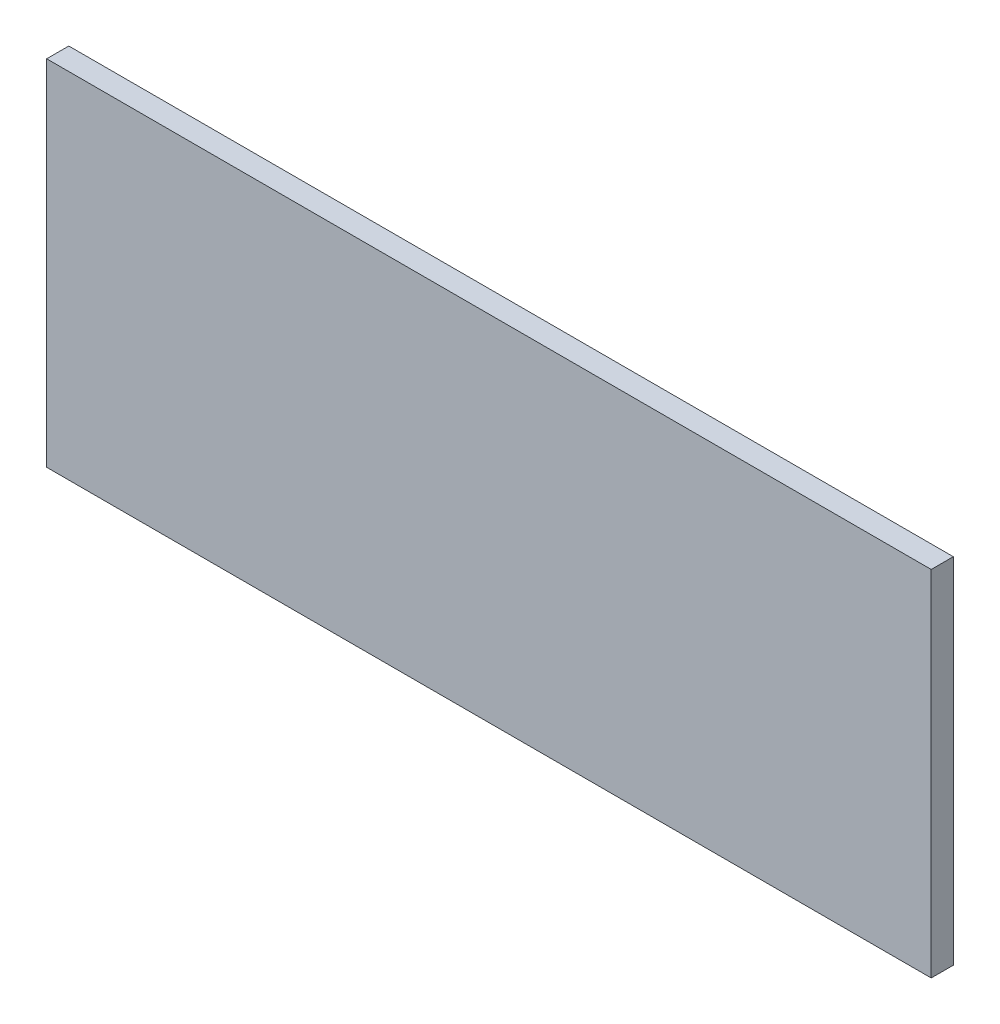
from build123d import *

# Parameters (mm, degrees)
SKETCH3_W           = 200
SKETCH3_H           = 80
BOSS_EXTRUDE1_DEPTH = 5


with BuildPart() as part:
    # Sketch3 → Boss-Extrude1 (new body)
    with BuildSketch(Plane.XY):
        with Locations((-100, 40)):
            Rectangle(SKETCH3_W, SKETCH3_H)
    extrude(amount=BOSS_EXTRUDE1_DEPTH)


solid = part.part
